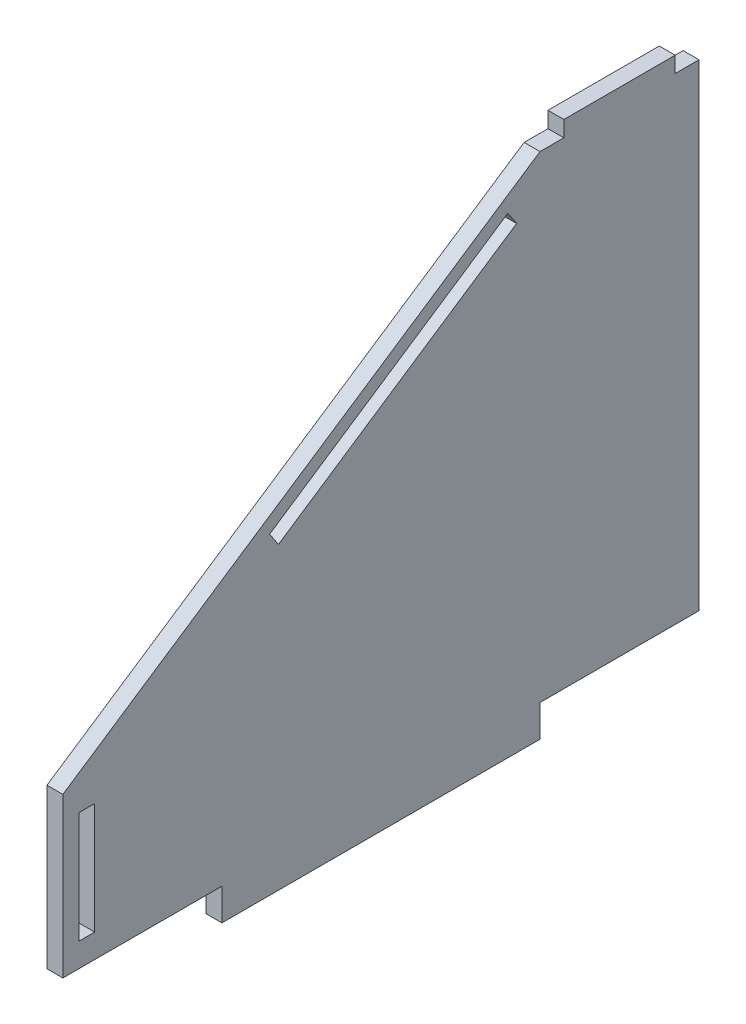
from build123d import *

# Parameters (mm, degrees)
CROQUIS1_W              = 5
CROQUIS1_H              = 35
SALIENTE_EXTRUIR1_DEPTH = 5


with BuildPart() as part:
    # Croquis1 → Saliente-Extruir1 (new body)
    with BuildSketch(Plane(origin=(0, 0, 0), x_dir=(0, 0, -1), z_dir=(1, 0, 0))):
        Polygon((150, 150), (0, 50), (0, 0), (50, 0), (50, -10), (150, -10), (150, 0), (200, 0), (200, 150), (192.5, 150), (192.5, 155), (157.5, 155), (157.5, 150), align=None)
        with Locations((7.5, 25)):
            Rectangle(CROQUIS1_W, CROQUIS1_H, mode=Mode.SUBTRACT)
        Polygon((65, 88.333333333), (139.88452649, 138.256350994), (142.658027472, 134.096099522), (67.773500981, 84.173081862), align=None, mode=Mode.SUBTRACT)
    extrude(amount=SALIENTE_EXTRUIR1_DEPTH)


solid = part.part
